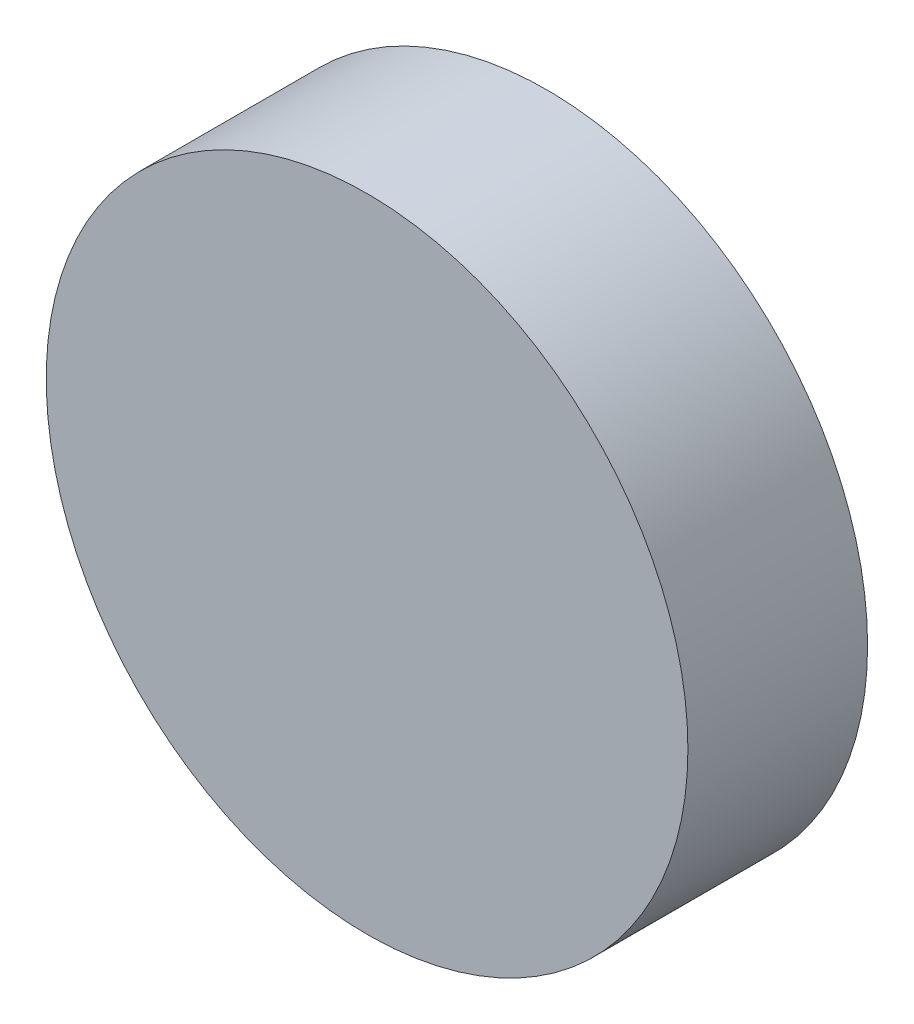
from build123d import *

# Parameters (mm, degrees)
SKETCH1_R           = 125
BOSS_EXTRUDE1_DEPTH = 70


with BuildPart() as part:
    # Sketch1 → Boss-Extrude1 (new body)
    with BuildSketch(Plane.XY):
        Circle(SKETCH1_R)
    extrude(amount=BOSS_EXTRUDE1_DEPTH)


solid = part.part
